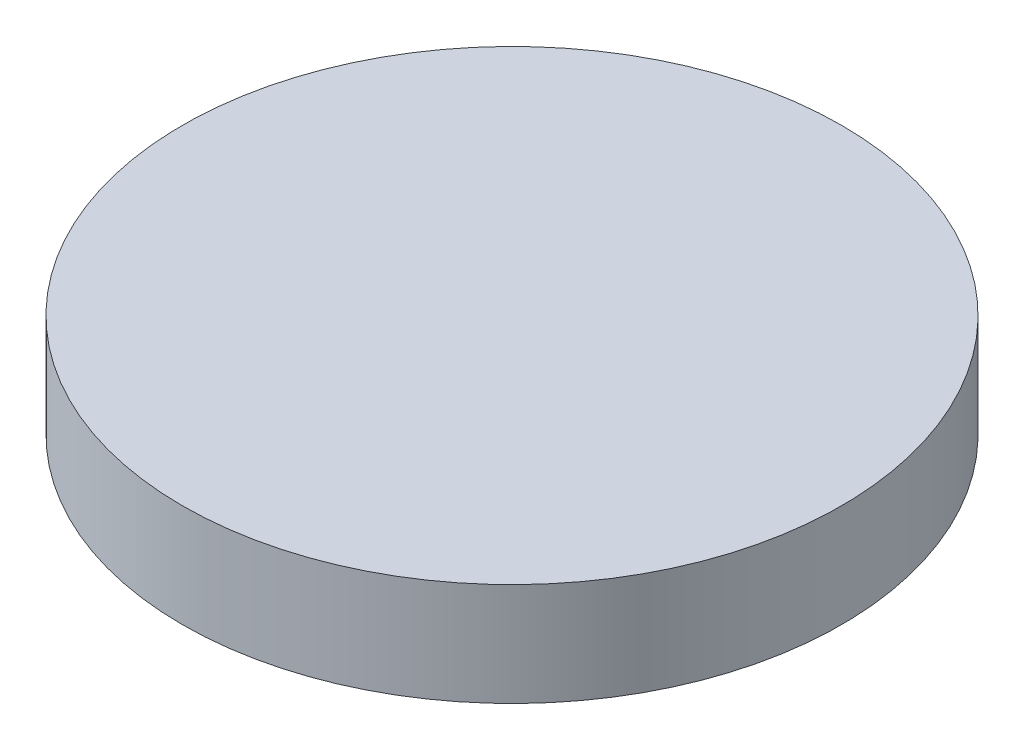
from build123d import *

# Parameters (mm, degrees)
SKETCH1_R           = 10.16
SKETCH1_R_2         = 4.550000044
SKETCH1_R_3         = 3.550000044
BOSS_EXTRUDE1_DEPTH = 3.175
SKETCH2_R           = 4.550000044
SKETCH2_R_2         = 3.550000044
CUT_EXTRUDE1_DEPTH  = 1.524


with BuildPart() as part:
    # Sketch1 → Boss-Extrude1 (new body)
    # profile 1 of 5: a face of its own
    with BuildSketch(Plane(origin=(0, 0, 0), x_dir=(1, 0, 0), z_dir=(0, 1, 0))):
        with Locations(Location((0, 0, 0), (0, 0, 270))):
            Circle(SKETCH1_R)
        with Locations((0, 4.953)):
            Circle(SKETCH1_R_2, mode=Mode.SUBTRACT)
        with Locations((0, -4.953)):
            Circle(SKETCH1_R_2, mode=Mode.SUBTRACT)
    # profile 2 of 5: a face of its own
    with BuildSketch(Plane(origin=(0, 0, 0), x_dir=(1, 0, 0), z_dir=(0, 1, 0))):
        with Locations((0, 4.953)):
            Circle(SKETCH1_R_2)
        with Locations((0, 4.953)):
            Circle(SKETCH1_R_3, mode=Mode.SUBTRACT)
    # profile 3 of 5: a face of its own
    with BuildSketch(Plane(origin=(0, 0, 0), x_dir=(1, 0, 0), z_dir=(0, 1, 0))):
        with Locations((0, 4.953)):
            Circle(SKETCH1_R_3)
    # profile 4 of 5: a face of its own
    with BuildSketch(Plane(origin=(0, 0, 0), x_dir=(1, 0, 0), z_dir=(0, 1, 0))):
        with Locations((0, -4.953)):
            Circle(SKETCH1_R_2)
        with Locations((0, -4.953)):
            Circle(SKETCH1_R_3, mode=Mode.SUBTRACT)
    # profile 5 of 5: a face of its own
    with BuildSketch(Plane(origin=(0, 0, 0), x_dir=(1, 0, 0), z_dir=(0, 1, 0))):
        with Locations((0, -4.953)):
            Circle(SKETCH1_R_3)
    extrude(amount=BOSS_EXTRUDE1_DEPTH)

    # Sketch2 → Cut-Extrude1 (cut)
    # profile 1 of 2: a face of its own
    with BuildSketch(Plane.XZ):
        with Locations(Location((0, -4.953, 0), (0, 0, 270))):
            Circle(SKETCH2_R)
        with Locations(Location((0, -4.953, 0), (0, 0, 270))):
            Circle(SKETCH2_R_2, mode=Mode.SUBTRACT)
    # profile 2 of 2: a face of its own
    with BuildSketch(Plane.XZ):
        with Locations(Location((0, 4.953, 0), (0, 0, 270))):
            Circle(SKETCH2_R)
        with Locations(Location((0, 4.953, 0), (0, 0, 270))):
            Circle(SKETCH2_R_2, mode=Mode.SUBTRACT)
    extrude(amount=-CUT_EXTRUDE1_DEPTH, mode=Mode.SUBTRACT)


solid = part.part
